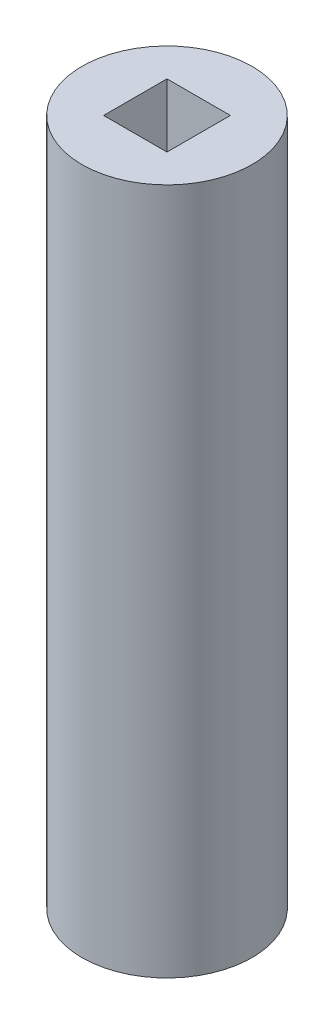
from build123d import *

# Parameters (mm, degrees)
SKETCH1_R           = 51.1302
SKETCH1_W           = 38.1
SKETCH1_H           = 38.1
BOSS_EXTRUDE1_DEPTH = 406.4
BOSS_EXTRUDE2_START = 6.35
SKETCH2_R           = 51.1302
BOSS_EXTRUDE2_DEPTH = 6.35


with BuildPart() as part:
    # Sketch1 → Boss-Extrude1 (new body)
    with BuildSketch(Plane(origin=(0, 0, 0), x_dir=(1, 0, 0), z_dir=(0, 1, 0))):
        with Locations(Location((0, 0, 0), (0, 0, 270))):
            Circle(SKETCH1_R)
        Rectangle(SKETCH1_W, SKETCH1_H, mode=Mode.SUBTRACT)
    extrude(amount=BOSS_EXTRUDE1_DEPTH)

    # Sketch2 → Boss-Extrude2 (add)
    with BuildSketch(Plane.XZ.offset(BOSS_EXTRUDE2_START)):
        with Locations(Location((0, 0, 0), (0, 0, 270))):
            Circle(SKETCH2_R)
    extrude(amount=-BOSS_EXTRUDE2_DEPTH)


solid = part.part
